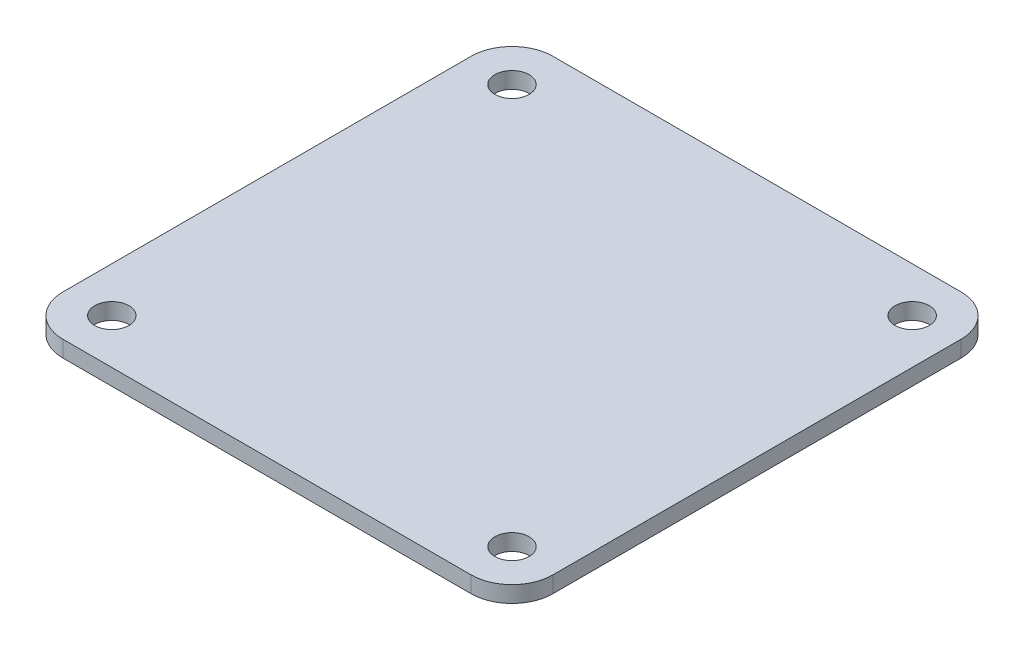
from build123d import *

# Parameters (mm, degrees)
BOSS_EXTRUDE1_DEPTH = 1


with BuildPart() as part:
    # Sketch1 → Boss-Extrude1 (new body)
    with BuildSketch(Plane(origin=(0, 0, 0), x_dir=(1, 0, 0), z_dir=(0, 1, 0))):
        with BuildLine():
            Line((-12.25, -13.3), (-12.25, -15))
            Line((-12.25, -15), (12.25, -15))
            Line((12.25, -15), (12.25, -13.3))
            ThreePointArc((12.25, -13.3), (11.50753788, -11.50753788), (13.3, -12.25))
            Line((13.3, -12.25), (15, -12.25))
            Line((15, -12.25), (15, 12.25))
            Line((15, 12.25), (13.3, 12.25))
            ThreePointArc((13.3, 12.25), (11.50753788, 11.50753788), (12.25, 13.3))
            Line((12.25, 13.3), (12.25, 15))
            Line((12.25, 15), (-12.25, 15))
            Line((-12.25, 15), (-12.25, 13.3))
            ThreePointArc((-12.25, 13.3), (-11.50753788, 12.99246212), (-11.2, 12.25))
            ThreePointArc((-11.2, 12.25), (-12.25, 11.2), (-13.3, 12.25))
            Line((-13.3, 12.25), (-15, 12.25))
            Line((-15, 12.25), (-15, -12.25))
            Line((-15, -12.25), (-13.3, -12.25))
            ThreePointArc((-13.3, -12.25), (-12.25, -11.2), (-11.2, -12.25))
            ThreePointArc((-11.2, -12.25), (-11.50753788, -12.99246212), (-12.25, -13.3))
        make_face()
        with BuildLine():
            Line((-15, 12.5), (-15, 12.25))
            Line((-15, 12.25), (-13.3, 12.25))
            ThreePointArc((-13.3, 12.25), (-12.99246212, 12.99246212), (-12.25, 13.3))
            Line((-12.25, 13.3), (-12.25, 15))
            Line((-12.25, 15), (-12.5, 15))
            ThreePointArc((-12.5, 15), (-14.267766953, 14.267766953), (-15, 12.5))
        make_face()
        with BuildLine():
            Line((13.3, 12.25), (15, 12.25))
            Line((15, 12.25), (15, 12.5))
            ThreePointArc((15, 12.5), (14.267766953, 14.267766953), (12.5, 15))
            Line((12.5, 15), (12.25, 15))
            Line((12.25, 15), (12.25, 13.3))
            ThreePointArc((12.25, 13.3), (12.99246212, 12.99246212), (13.3, 12.25))
        make_face()
        with BuildLine():
            Line((12.25, -13.3), (12.25, -15))
            Line((12.25, -15), (12.5, -15))
            ThreePointArc((12.5, -15), (14.267766953, -14.267766953), (15, -12.5))
            Line((15, -12.5), (15, -12.25))
            Line((15, -12.25), (13.3, -12.25))
            ThreePointArc((13.3, -12.25), (12.99246212, -12.99246212), (12.25, -13.3))
        make_face()
        with BuildLine():
            ThreePointArc((-15, -12.5), (-14.267766953, -14.267766953), (-12.5, -15))
            Line((-12.5, -15), (-12.25, -15))
            Line((-12.25, -15), (-12.25, -13.3))
            ThreePointArc((-12.25, -13.3), (-12.99246212, -12.99246212), (-13.3, -12.25))
            Line((-13.3, -12.25), (-15, -12.25))
            Line((-15, -12.25), (-15, -12.5))
        make_face()
    extrude(amount=BOSS_EXTRUDE1_DEPTH)


solid = part.part
